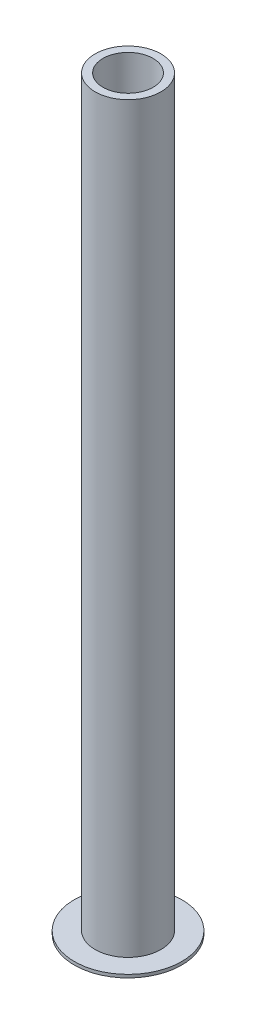
from build123d import *

# Parameters (mm, degrees)
SKETCH1_R           = 5.334
SKETCH1_R_2         = 4.064
BOSS_EXTRUDE1_DEPTH = 120.396
BOSS_EXTRUDE2_START = 0.508
SKETCH2_R           = 8.6995
SKETCH2_R_2         = 4.064
BOSS_EXTRUDE2_DEPTH = 0.508


with BuildPart() as part:
    # Sketch1 → Boss-Extrude1 (new body)
    with BuildSketch(Plane(origin=(0, 0, 0), x_dir=(1, 0, 0), z_dir=(0, 1, 0))):
        with Locations(Location((0, 0, 0), (0, 0, 90))):
            Circle(SKETCH1_R)
        with Locations(Location((0, 0, 0), (0, 0, 90))):
            Circle(SKETCH1_R_2, mode=Mode.SUBTRACT)
    extrude(amount=BOSS_EXTRUDE1_DEPTH)

    # Sketch2 → Boss-Extrude2 (add)
    with BuildSketch(Plane.XZ.offset(BOSS_EXTRUDE2_START)):
        with Locations(Location((0, 0, 0), (0, 0, 270))):
            Circle(SKETCH2_R)
        with Locations(Location((0, 0, 0), (0, 0, 270))):
            Circle(SKETCH2_R_2, mode=Mode.SUBTRACT)
    extrude(amount=-BOSS_EXTRUDE2_DEPTH)


solid = part.part
